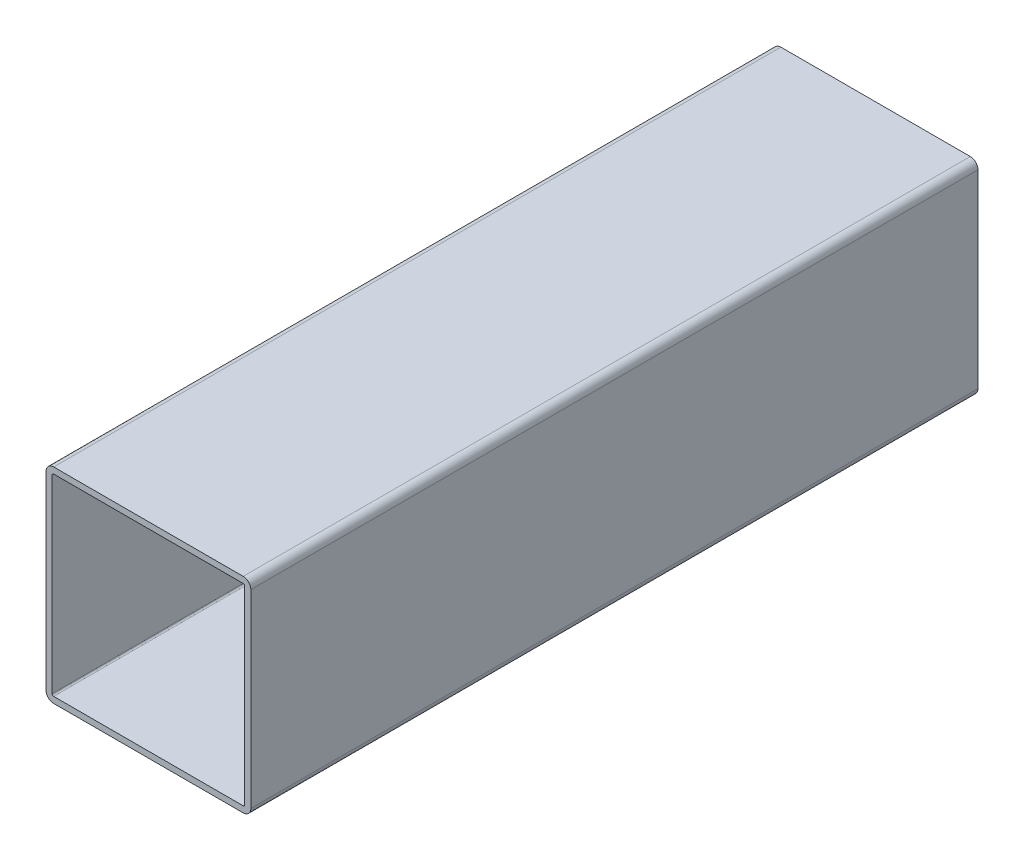
from build123d import *

# Parameters (mm, degrees)
STRUCTURAL_MEMBER1_DEPTH = 142


with BuildPart() as part:
    # Sketch12 → Structural Member1 (new body)
    with BuildSketch(Plane(origin=(0, 0, 0), x_dir=(-1, 0, 0), z_dir=(0, 0, -1))):
        with BuildLine():
            Line((-18.5, -20), (18.5, -20))
            ThreePointArc((18.5, -20), (19.560660172, -19.560660172), (20, -18.5))
            Line((20, -18.5), (20, 18.5))
            ThreePointArc((20, 18.5), (19.560660172, 19.560660172), (18.5, 20))
            Line((18.5, 20), (-18.5, 20))
            ThreePointArc((-18.5, 20), (-19.560660172, 19.560660172), (-20, 18.5))
            Line((-20, 18.5), (-20, -18.5))
            ThreePointArc((-20, -18.5), (-19.560660172, -19.560660172), (-18.5, -20))
        make_face()
        with BuildLine():
            Line((-18.5, -18.8), (18.5, -18.8))
            ThreePointArc((18.5, -18.8), (18.712132034, -18.712132034), (18.8, -18.5))
            Line((18.8, -18.5), (18.8, 18.5))
            ThreePointArc((18.8, 18.5), (18.712132034, 18.712132034), (18.5, 18.8))
            Line((18.5, 18.8), (-18.5, 18.8))
            ThreePointArc((-18.5, 18.8), (-18.712132034, 18.712132034), (-18.8, 18.5))
            Line((-18.8, 18.5), (-18.8, -18.5))
            ThreePointArc((-18.8, -18.5), (-18.712132034, -18.712132034), (-18.5, -18.8))
        make_face(mode=Mode.SUBTRACT)
    extrude(amount=STRUCTURAL_MEMBER1_DEPTH)


solid = part.part
